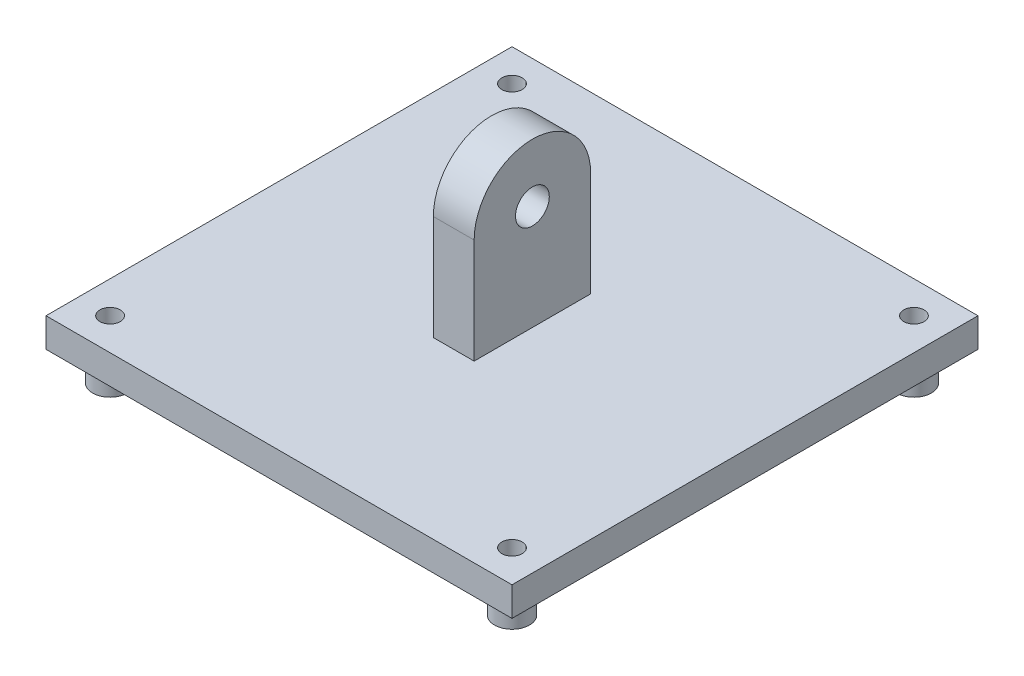
from build123d import *

# Parameters (mm, degrees)
SKETCH2_W           = 80
SKETCH2_H           = 80
BOSS_EXTRUDE1_DEPTH = 5
SKETCH9_R           = 3
BOSS_EXTRUDE3_DEPTH = 5
SKETCH10_R          = 1.75
CUT_EXTRUDE6_DEPTH  = 58.445626465
SKETCH11_R          = 2.9
BOSS_EXTRUDE4_DEPTH = 80
SKETCH12_W          = 80
SKETCH12_H          = 80
SKETCH12_W_2        = 7
SKETCH12_H_2        = 20
CUT_EXTRUDE7_DEPTH  = 64.118935352


with BuildPart() as part:
    # Sketch2 → Boss-Extrude1 (new body)
    with BuildSketch(Plane(origin=(0, 0, 0), x_dir=(1, 0, 0), z_dir=(0, 1, 0))):
        Rectangle(SKETCH2_W, SKETCH2_H)
    extrude(amount=BOSS_EXTRUDE1_DEPTH)

    # Sketch9 → Boss-Extrude3 (add)
    with BuildSketch(Plane.XZ):
        with Locations(Location((-34.5, 34.5, 0), (0, 0, 270))):
            Circle(SKETCH9_R)
        with Locations(Location((34.5, 34.5, 0), (0, 0, 270))):
            Circle(SKETCH9_R)
        with Locations(Location((-34.5, -34.5, 0), (0, 0, 270))):
            Circle(SKETCH9_R)
        with Locations(Location((34.5, -34.5, 0), (0, 0, 270))):
            Circle(SKETCH9_R)
    extrude(amount=BOSS_EXTRUDE3_DEPTH)

    # Sketch10 → Cut-Extrude6 (cut, through all)
    with BuildSketch(Plane.XZ.offset(5)):
        with Locations(Location((-34.5, -34.5, 0), (0, 0, 270))):
            Circle(SKETCH10_R)
        with Locations(Location((-34.5, 34.5, 0), (0, 0, 270))):
            Circle(SKETCH10_R)
        with Locations(Location((34.5, 34.5, 0), (0, 0, 270))):
            Circle(SKETCH10_R)
        with Locations(Location((34.5, -34.5, 0), (0, 0, 270))):
            Circle(SKETCH10_R)
    extrude(amount=-CUT_EXTRUDE6_DEPTH, mode=Mode.SUBTRACT)

    # Sketch11 → Boss-Extrude4 (add)
    with BuildSketch(Plane(origin=(40, 0, 0), x_dir=(0, 0, -1), z_dir=(1, 0, 0))):
        with BuildLine():
            Line((-10, 5), (-10, 23))
            ThreePointArc((-10, 23), (0, 33), (10, 23))
            Line((10, 23), (10, 5))
            Line((10, 5), (-10, 5))
        make_face()
        with Locations((0, 23)):
            Circle(SKETCH11_R, mode=Mode.SUBTRACT)
    extrude(amount=-BOSS_EXTRUDE4_DEPTH)

    # Sketch12 → Cut-Extrude7 (cut, through all)
    with BuildSketch(Plane(origin=(0, 5, 0), x_dir=(1, 0, 0), z_dir=(0, 1, 0))):
        Rectangle(SKETCH12_W, SKETCH12_H)
        Rectangle(SKETCH12_W_2, SKETCH12_H_2, mode=Mode.SUBTRACT)
    extrude(amount=CUT_EXTRUDE7_DEPTH, mode=Mode.SUBTRACT)


solid = part.part
